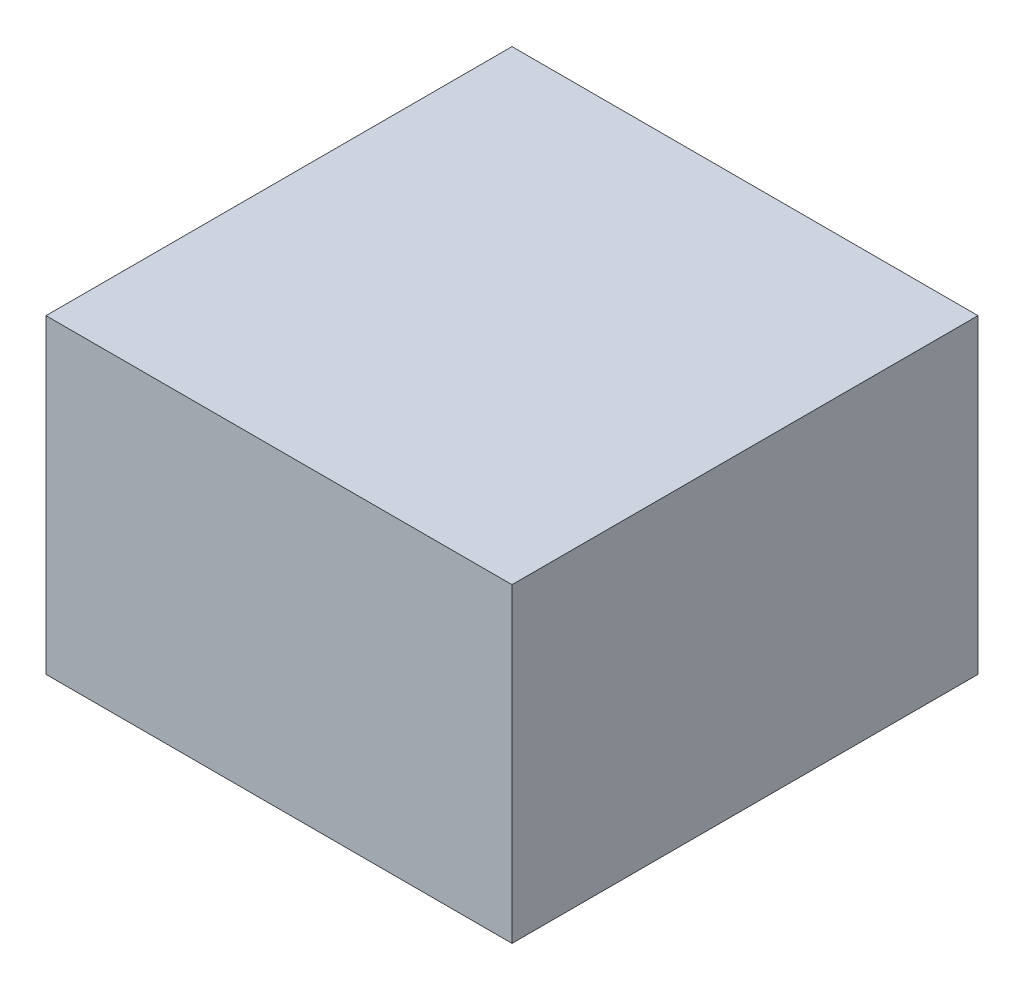
from build123d import *

# Parameters (mm, degrees)
SKETCH1_W           = 150
SKETCH1_H           = 150
BOSS_EXTRUDE1_DEPTH = 100


with BuildPart() as part:
    # Sketch1 → Boss-Extrude1 (new body)
    with BuildSketch(Plane(origin=(0, 0, 0), x_dir=(1, 0, 0), z_dir=(0, 1, 0))):
        with Locations((75, -75)):
            Rectangle(SKETCH1_W, SKETCH1_H)
    extrude(amount=BOSS_EXTRUDE1_DEPTH)


solid = part.part
